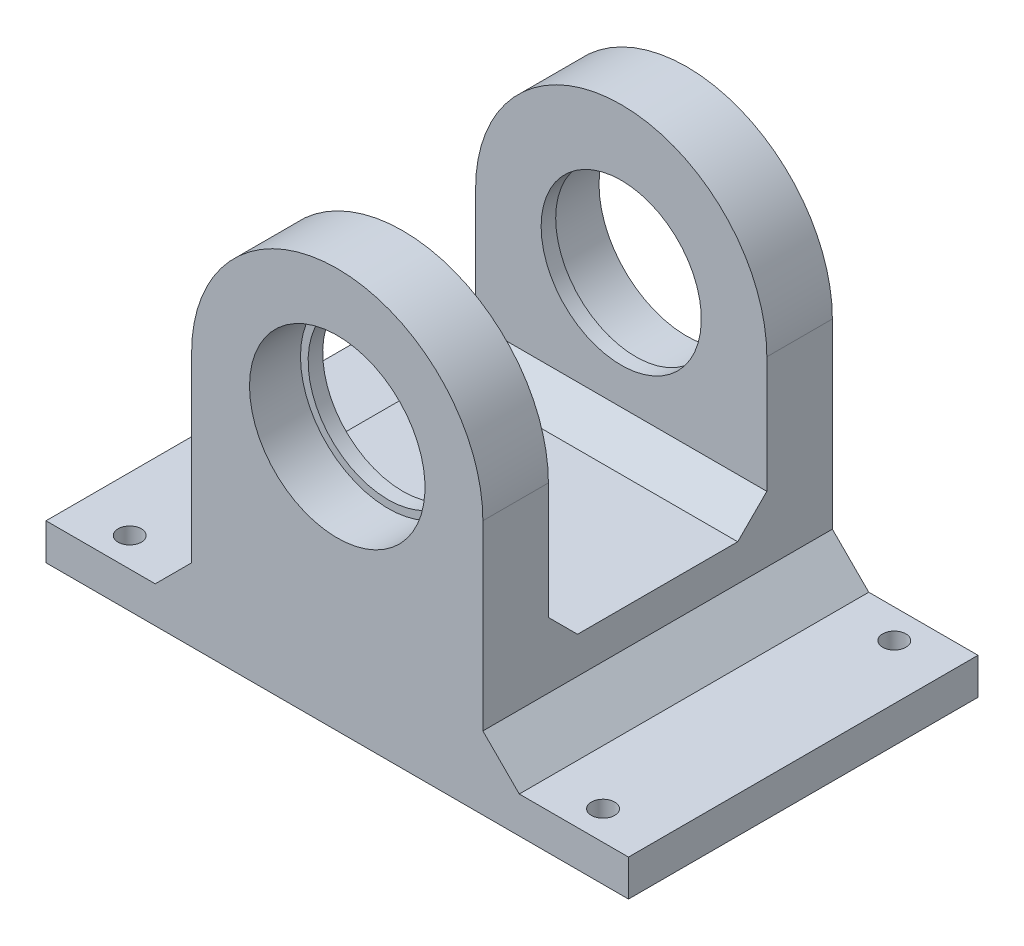
from build123d import *

# Parameters (mm, degrees)
SKETCH_1_R               = 11
EXTRUDE_1_DEPTH          = 24
CUT_EXTRUDE_1_DEPTH      = 47.914816423
CUT_EXTRUDE_1_DEPTH_BACK = 47.914816423
SKETCH_2_W               = 30
SKETCH_2_H               = 69.949963181
SKETCH_4_R               = 12.05
CUT_EXTRUDE_3_DEPTH      = 7
CHAMFER_2_SIZE           = 4
SKETCH_5_W               = 48
SKETCH_5_H               = 5
EXTRUDE_2_DEPTH          = 20
CHAMFER_3_SIZE           = 5
SKETCH_6_R               = 1.6
CUT_EXTRUDE_4_DEPTH      = 73.117958928


with BuildPart() as part:
    # 草图1 → 凸台-拉伸1 (new, symmetric)
    with BuildSketch(Plane.XY):
        with BuildLine():
            Line((-20, -35), (-20, 0))
            ThreePointArc((-20, 0), (0, 20), (20, 0))
            Line((20, 0), (20, -35))
            Line((20, -35), (-20, -35))
        make_face()
        Circle(SKETCH_1_R, mode=Mode.SUBTRACT)
    extrude(amount=EXTRUDE_1_DEPTH, both=True)

    # 草图2 → 切除-拉伸1 (cut, two sides: drawn at the far end of the back side and taken through both)
    with BuildSketch(Plane(origin=(0, 0, 0), x_dir=(0, 0, -1), z_dir=(1, 0, 0)).offset(-CUT_EXTRUDE_1_DEPTH_BACK)):
        with Locations((0, 14.974981591)):
            Rectangle(SKETCH_2_W, SKETCH_2_H)
    extrude(amount=CUT_EXTRUDE_1_DEPTH + CUT_EXTRUDE_1_DEPTH_BACK, mode=Mode.SUBTRACT)

    # 草图4 → 切除-拉伸3 (cut)
    with BuildSketch(Plane(origin=(0, 0, -24), x_dir=(-1, 0, 0), z_dir=(0, 0, -1))):
        Circle(SKETCH_4_R)
    cut_extrude_3 = extrude(amount=-CUT_EXTRUDE_3_DEPTH, mode=Mode.SUBTRACT)

    # 倒角2
    chamfer_2_edges = [part.edges().sort_by_distance(p)[0] for p in [
        (0, -20, 15),
        (0, -20, -15),
    ]]
    chamfer(chamfer_2_edges, length=CHAMFER_2_SIZE)

    # 镜向1: 切除-拉伸3 across plane
    add(cut_extrude_3.mirror(Plane.XY), mode=Mode.SUBTRACT)

    # 草图5 → 凸台-拉伸2 (add)
    with BuildSketch(Plane.ZY.offset(20)):
        with Locations((0, -32.5)):
            Rectangle(SKETCH_5_W, SKETCH_5_H)
    extrude_2 = extrude(amount=EXTRUDE_2_DEPTH)

    # 镜向2: 凸台-拉伸2 across plane
    add(extrude_2.mirror(Plane.ZY))

    # 倒角3
    chamfer_3_edges = [part.edges().sort_by_distance(p)[0] for p in [
        (-20, -30, 0),
        (20, -30, 0),
    ]]
    chamfer(chamfer_3_edges, length=CHAMFER_3_SIZE)

    # 草图6 → 切除-拉伸4 (cut, through all)
    with BuildSketch(Plane.XZ.offset(35)):
        with Locations(Location((32.5, -20, 0), (0, 0, 270))):
            Circle(SKETCH_6_R)
        with Locations(Location((-32.5, -20, 0), (0, 0, 270))):
            Circle(SKETCH_6_R)
        with Locations(Location((-32.5, 20, 0), (0, 0, 270))):
            Circle(SKETCH_6_R)
        with Locations(Location((32.5, 20, 0), (0, 0, 90))):
            Circle(SKETCH_6_R)
    extrude(amount=-CUT_EXTRUDE_4_DEPTH, mode=Mode.SUBTRACT)


solid = part.part
